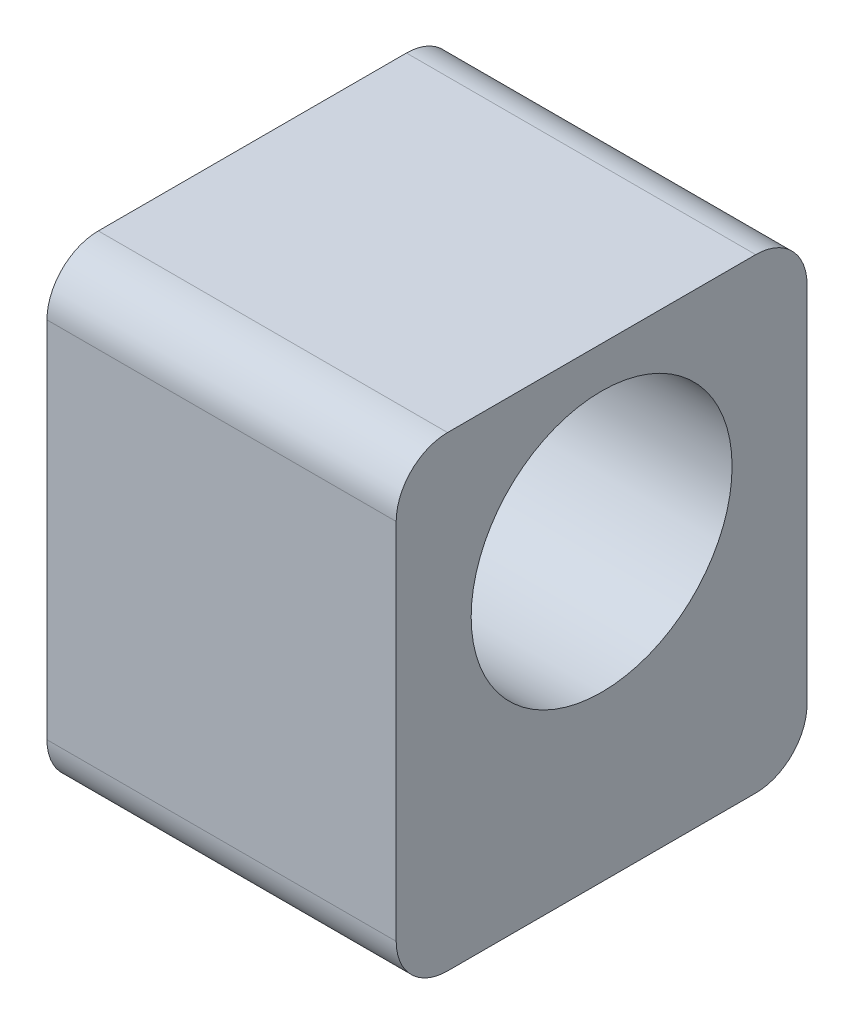
from build123d import *

# Parameters (mm, degrees)
SKETCH1_R           = 12.7
BOSS_EXTRUDE1_DEPTH = 17


with BuildPart() as part:
    # Sketch1 → Boss-Extrude1 (new, symmetric)
    with BuildSketch(Plane(origin=(0, 0, 0), x_dir=(0, 0, -1), z_dir=(1, 0, 0))):
        with BuildLine():
            Line((-15, -28.7), (15, -28.7))
            ThreePointArc((15, -28.7), (18.535533906, -27.235533906), (20, -23.7))
            Line((20, -23.7), (20, 11.7))
            ThreePointArc((20, 11.7), (18.535533906, 15.235533906), (15, 16.7))
            Line((15, 16.7), (-15, 16.7))
            ThreePointArc((-15, 16.7), (-18.535533906, 15.235533906), (-20, 11.7))
            Line((-20, 11.7), (-20, -23.7))
            ThreePointArc((-20, -23.7), (-18.535533906, -27.235533906), (-15, -28.7))
        make_face()
        Circle(SKETCH1_R, mode=Mode.SUBTRACT)
    extrude(amount=BOSS_EXTRUDE1_DEPTH, both=True)


solid = part.part
